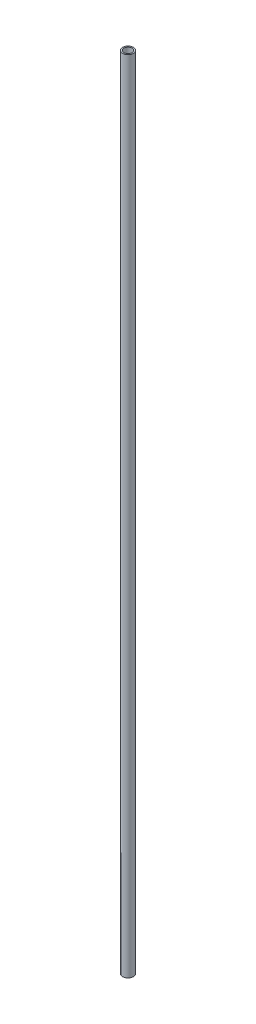
from build123d import *

# Parameters (mm, degrees)
SKETCH1_R           = 4
SKETCH1_R_2         = 3
BOSS_EXTRUDE1_DEPTH = 300


with BuildPart() as part:
    # Sketch1 → Boss-Extrude1 (new, symmetric)
    with BuildSketch(Plane(origin=(0, 0, 0), x_dir=(1, 0, 0), z_dir=(0, 1, 0))):
        with Locations(Location((0, 0, 0), (0, 0, 270))):
            Circle(SKETCH1_R)
        with Locations(Location((0, 0, 0), (0, 0, 270))):
            Circle(SKETCH1_R_2, mode=Mode.SUBTRACT)
    extrude(amount=BOSS_EXTRUDE1_DEPTH, both=True)


solid = part.part
